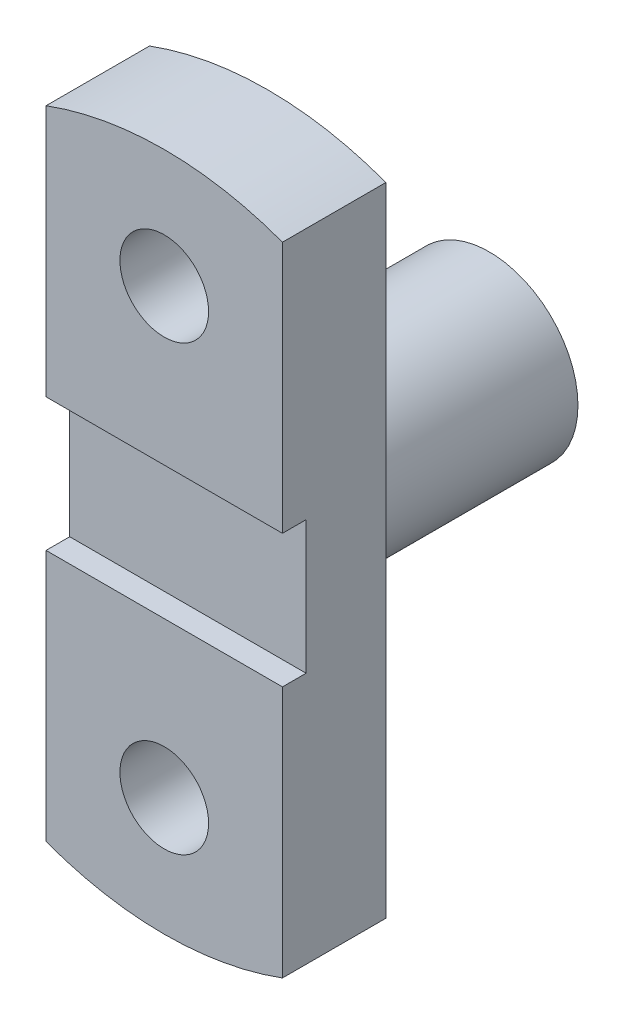
from build123d import *

# Parameters (mm, degrees)
SKETCH1_R           = 15
BOSS_EXTRUDE1_DEPTH = 35
SKETCH2_W           = 8
SKETCH2_H           = 45
CUT_EXTRUDE1_DEPTH  = 216
SKETCH3_R           = 30
BOSS_EXTRUDE2_DEPTH = 75


with BuildPart() as part:
    # Sketch1 → Boss-Extrude1 (new body)
    with BuildSketch(Plane.XY):
        with BuildLine():
            Line((-40, 107.819293264), (-40, -107.819293264))
            ThreePointArc((-40, -107.819293264), (0, -115), (40, -107.819293264))
            Line((40, -107.819293264), (40, 107.819293264))
            ThreePointArc((40, 107.819293264), (0, 115), (-40, 107.819293264))
        make_face()
        with Locations((0, 75)):
            Circle(SKETCH1_R, mode=Mode.SUBTRACT)
        with Locations((0, -75)):
            Circle(SKETCH1_R, mode=Mode.SUBTRACT)
    extrude(amount=BOSS_EXTRUDE1_DEPTH)

    # Sketch2 → Cut-Extrude1 (cut)
    with BuildSketch(Plane(origin=(40, 0, 0), x_dir=(0, 0, -1), z_dir=(1, 0, 0))):
        with Locations((-31, 0)):
            Rectangle(SKETCH2_W, SKETCH2_H)
    extrude(amount=-CUT_EXTRUDE1_DEPTH, mode=Mode.SUBTRACT)

    # Sketch3 → Boss-Extrude2 (add)
    with BuildSketch(Plane(origin=(0, 0, 0), x_dir=(-1, 0, 0), z_dir=(0, 0, -1))):
        with Locations(Location((0, 0, 0), (0, 0, 180))):
            Circle(SKETCH3_R)
    extrude(amount=BOSS_EXTRUDE2_DEPTH)


solid = part.part
